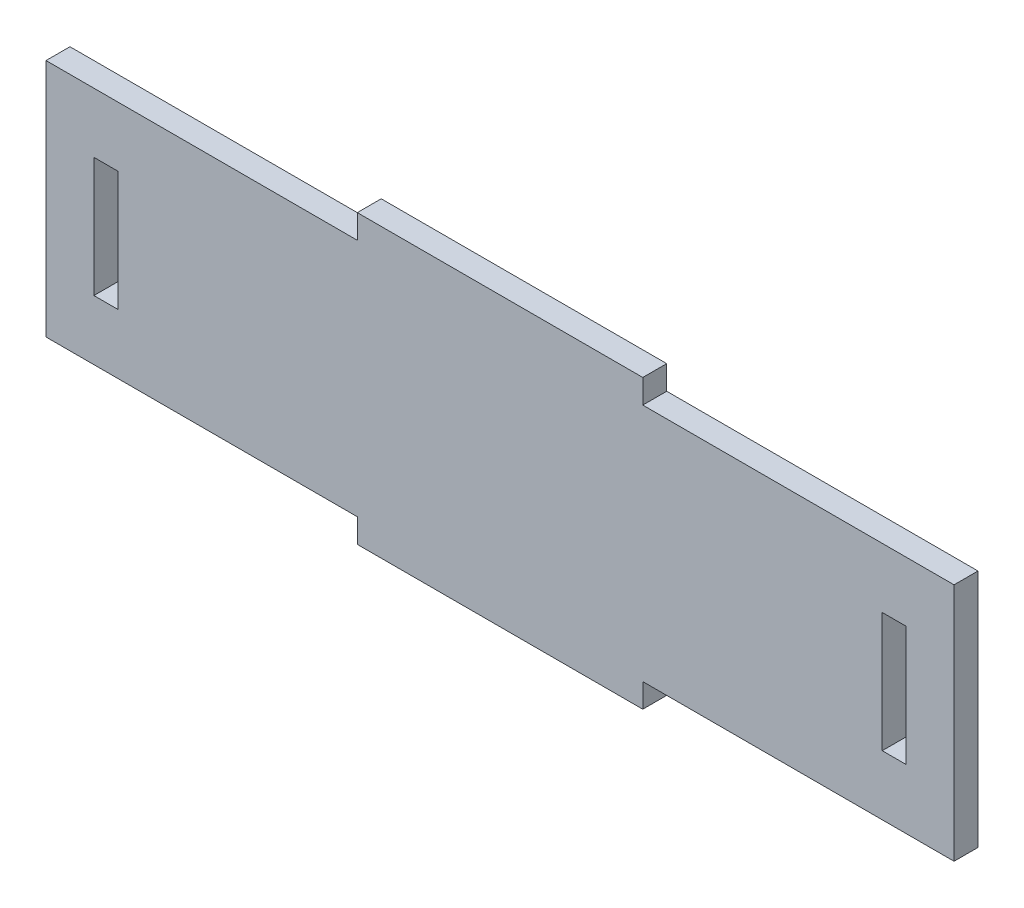
from build123d import *

# Parameters (mm, degrees)
SKETCH1_W           = 2
SKETCH1_H           = 10
BOSS_EXTRUDE1_DEPTH = 2


with BuildPart() as part:
    # Sketch1 → Boss-Extrude1 (new body)
    with BuildSketch(Plane.XY):
        Polygon((0, 0), (24, 0), (24, -2), (47.848, -2), (47.848, 0), (71.848, 0), (73.848, 0), (73.848, 20), (71.848, 20), (47.848, 20), (47.848, 22), (24, 22), (24, 20), (0, 20), (-2, 20), (-2, 0), align=None)
        with Locations((3, 10)):
            Rectangle(SKETCH1_W, SKETCH1_H, mode=Mode.SUBTRACT)
        with Locations((68.848, 10)):
            Rectangle(SKETCH1_W, SKETCH1_H, mode=Mode.SUBTRACT)
    extrude(amount=BOSS_EXTRUDE1_DEPTH)


solid = part.part
